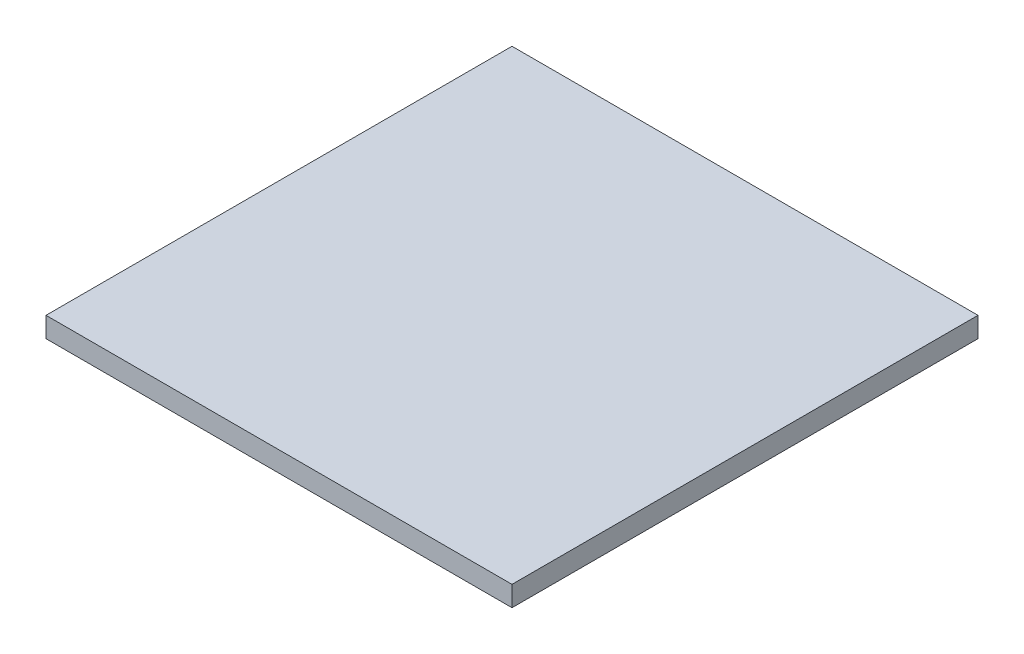
from build123d import *

# Parameters (mm, degrees)
SKETCH2_W           = 292.1
SKETCH2_H           = 292.1
BOSS_EXTRUDE1_DEPTH = 12.7


with BuildPart() as part:
    # Sketch2 → Boss-Extrude1 (new body)
    with BuildSketch(Plane(origin=(0, 0, 0), x_dir=(1, 0, 0), z_dir=(0, 1, 0))):
        Rectangle(SKETCH2_W, SKETCH2_H)
    extrude(amount=BOSS_EXTRUDE1_DEPTH)


solid = part.part
